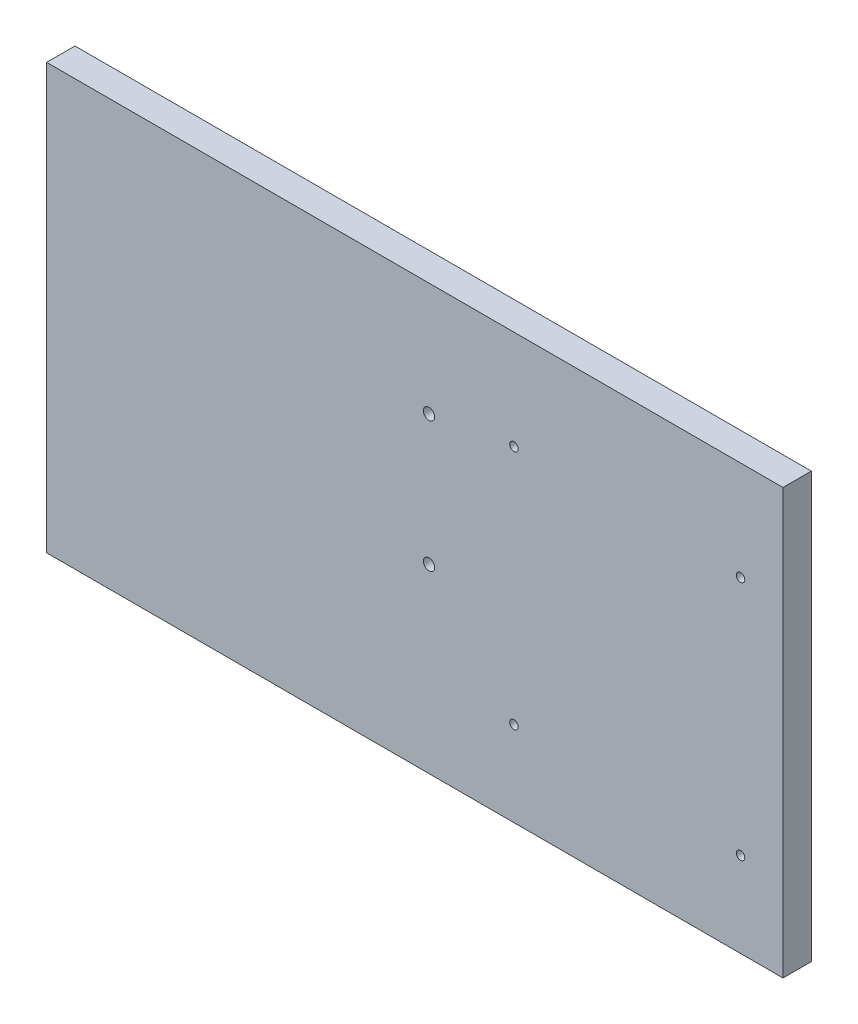
from build123d import *

# Parameters (mm, degrees)
ESBO_O1_W                = 260
ESBO_O1_H                = 150
ESBO_O1_R                = 1.5
ESBO_O1_R_2              = 2
RESSALTO_EXTRUS_O1_DEPTH = 10


with BuildPart() as part:
    # Esboço1 → Ressalto-extrusão1 (new body)
    with BuildSketch(Plane.XY):
        Rectangle(ESBO_O1_W, ESBO_O1_H)
        with Locations((115, 40)):
            Circle(ESBO_O1_R, mode=Mode.SUBTRACT)
        with Locations((115, -45)):
            Circle(ESBO_O1_R, mode=Mode.SUBTRACT)
        with Locations((35, -45)):
            Circle(ESBO_O1_R, mode=Mode.SUBTRACT)
        with Locations((35, 40)):
            Circle(ESBO_O1_R, mode=Mode.SUBTRACT)
        with Locations((5, 35)):
            Circle(ESBO_O1_R_2, mode=Mode.SUBTRACT)
        with Locations((5, -11)):
            Circle(ESBO_O1_R_2, mode=Mode.SUBTRACT)
    extrude(amount=RESSALTO_EXTRUS_O1_DEPTH)


solid = part.part
